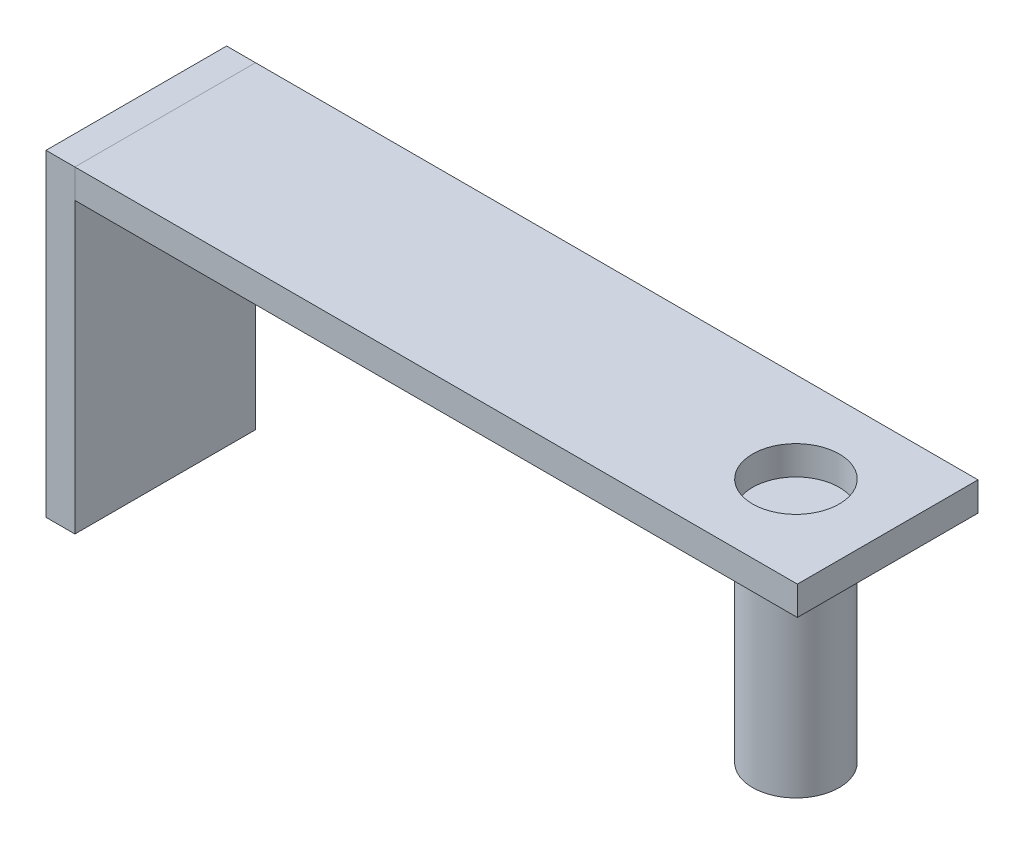
from build123d import *

# Parameters (mm, degrees)
BOSS_EXTRUDE6_DEPTH      = 2
BOSS_EXTRUDE6_DEPTH_BACK = 20
SKETCH1_W                = 2
SKETCH1_H                = 12.5
SKETCH1_4_W              = 50
SKETCH1_4_H              = 12.5
SKETCH1_4_R              = 3
BOSS_EXTRUDE7_DEPTH      = 2
SKETCH1_5_R              = 3
BOSS_EXTRUDE8_DEPTH      = 15


with BuildPart() as part:
    # Sketch1 → Boss-Extrude6 (new, two sides: drawn at the far end of the back side and taken through both)
    with BuildSketch(Plane(origin=(0, 0, 0), x_dir=(1, 0, 0), z_dir=(0, 1, 0)).offset(-BOSS_EXTRUDE6_DEPTH_BACK)):
        with Locations((-26, 0)):
            Rectangle(SKETCH1_W, SKETCH1_H)
    extrude(amount=BOSS_EXTRUDE6_DEPTH + BOSS_EXTRUDE6_DEPTH_BACK)


with BuildPart() as body_2:
    # Sketch1<4> → Boss-Extrude7 (new body)
    with BuildSketch(Plane(origin=(0, 0, 0), x_dir=(1, 0, 0), z_dir=(0, 1, 0))):
        Rectangle(SKETCH1_4_W, SKETCH1_4_H)
        with Locations((18.65, 0)):
            Circle(SKETCH1_4_R, mode=Mode.SUBTRACT)
    extrude(amount=BOSS_EXTRUDE7_DEPTH)


with BuildPart() as body_3:
    # Sketch1<5> → Boss-Extrude8 (new body)
    with BuildSketch(Plane(origin=(0, 0, 0), x_dir=(1, 0, 0), z_dir=(0, 1, 0))):
        with Locations((18.65, 0)):
            Circle(SKETCH1_5_R)
    extrude(amount=-BOSS_EXTRUDE8_DEPTH)


solid = Compound([part.part, body_2.part, body_3.part])
